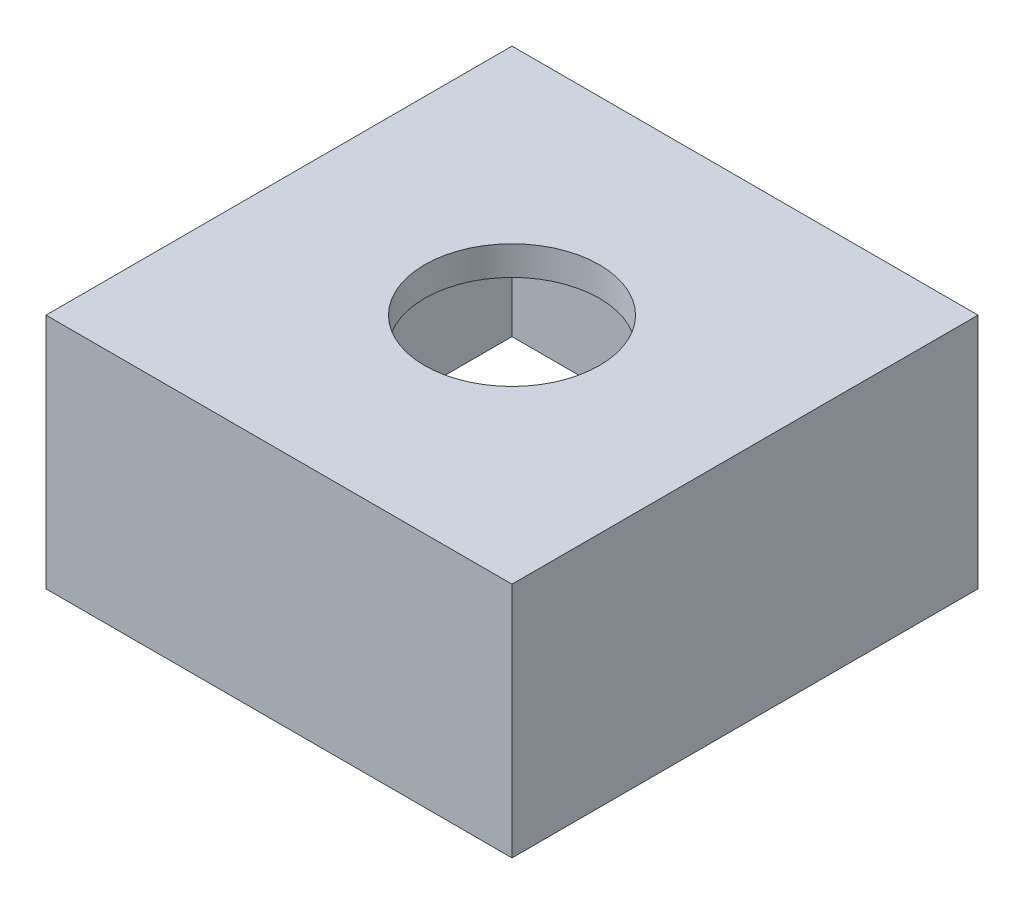
from build123d import *

# Parameters (mm, degrees)
SKETCH1_W           = 203.2
SKETCH1_H           = 203.2
SKETCH1_W_2         = 190.5
SKETCH1_H_2         = 190.5
BOSS_EXTRUDE1_DEPTH = 90.678
SKETCH2_W           = 203.2
SKETCH2_H           = 203.2
BOSS_EXTRUDE2_DEPTH = 12.7
SKETCH4_R           = 38.1
CUT_EXTRUDE3_DEPTH  = 178.008844084


with BuildPart() as part:
    # Sketch1 → Boss-Extrude1 (new body)
    with BuildSketch(Plane(origin=(0, 0, 0), x_dir=(1, 0, 0), z_dir=(0, 1, 0))):
        Rectangle(SKETCH1_W, SKETCH1_H)
        Rectangle(SKETCH1_W_2, SKETCH1_H_2, mode=Mode.SUBTRACT)
    extrude(amount=BOSS_EXTRUDE1_DEPTH)

    # Sketch2 → Boss-Extrude2 (add)
    with BuildSketch(Plane(origin=(0, 90.678, 0), x_dir=(1, 0, 0), z_dir=(0, 1, 0))):
        Rectangle(SKETCH2_W, SKETCH2_H)
    extrude(amount=BOSS_EXTRUDE2_DEPTH)

    # Sketch4 → Cut-Extrude3 (cut, through all)
    with BuildSketch(Plane(origin=(0, 103.378, 0), x_dir=(1, 0, 0), z_dir=(0, 1, 0))):
        with Locations(Location((0, 0, 0), (0, 0, 270))):
            Circle(SKETCH4_R)
    extrude(amount=-CUT_EXTRUDE3_DEPTH, mode=Mode.SUBTRACT)


solid = part.part
